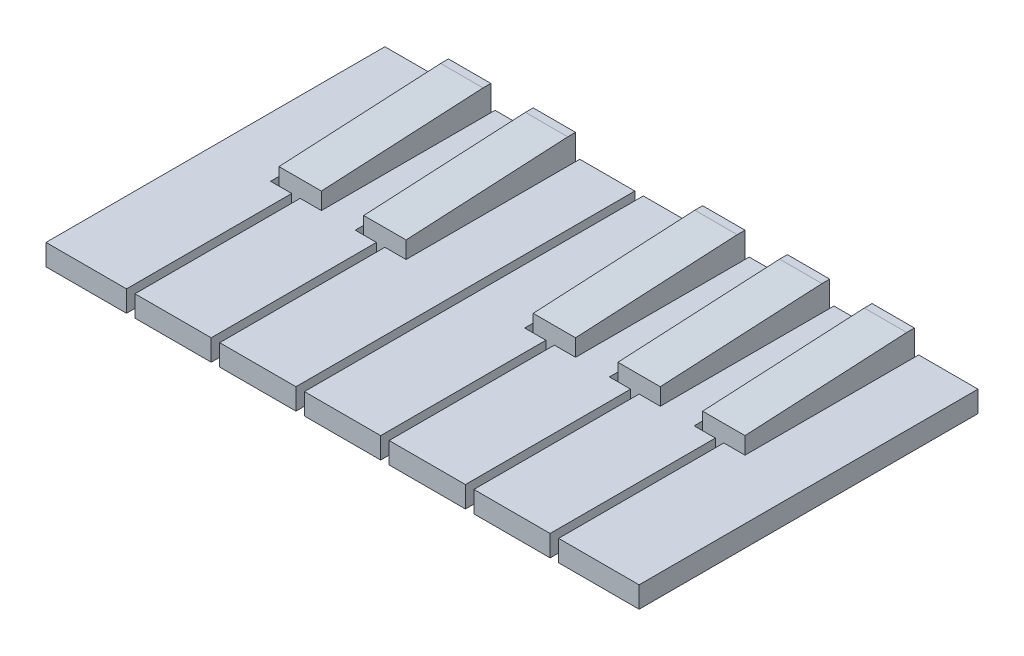
from build123d import *

# Parameters (mm, degrees)
SKETCH1_W             = 10
SKETCH1_H             = 40
BOSS_EXTRUDE1_DEPTH   = 10
BOSS_EXTRUDE1_2_DEPTH = 10
BOSS_EXTRUDE1_3_DEPTH = 10
BOSS_EXTRUDE1_4_DEPTH = 10
BOSS_EXTRUDE1_5_DEPTH = 10
BOSS_EXTRUDE2_DEPTH   = 5
BOSS_EXTRUDE2_2_DEPTH = 5
BOSS_EXTRUDE2_3_DEPTH = 5
BOSS_EXTRUDE2_4_DEPTH = 5
BOSS_EXTRUDE2_5_DEPTH = 5
BOSS_EXTRUDE2_6_DEPTH = 5
BOSS_EXTRUDE2_7_DEPTH = 5
CHAMFER1_SIZE         = 2
CHAMFER1_SIZE2        = 38.162273375
CHAMFER2_SIZE         = 2
CHAMFER2_SIZE2        = 38.162273375
CHAMFER3_SIZE         = 2
CHAMFER3_SIZE2        = 38.162273375
CHAMFER4_SIZE         = 2
CHAMFER4_SIZE2        = 38.162273375
CHAMFER5_SIZE         = 2
CHAMFER5_SIZE2        = 38.162273375


with BuildPart() as part:
    # Sketch1 → Boss-Extrude1 (new body)
    with BuildSketch(Plane(origin=(0, 0, 0), x_dir=(1, 0, 0), z_dir=(0, 1, 0))):
        with Locations((20, 60)):
            Rectangle(SKETCH1_W, SKETCH1_H)
    extrude(amount=BOSS_EXTRUDE1_DEPTH)

    # Chamfer1
    chamfer1_edges = [part.edges().sort_by_distance(p)[0] for p in [
        (20, 10, -40),
    ]]
    chamfer1_side = [part.faces().sort_by_distance(p)[0] for p in [
        (20, 5, -40),
    ]]
    chamfer(chamfer1_edges, length=CHAMFER1_SIZE, length2=CHAMFER1_SIZE2, reference=chamfer1_side[0])


with BuildPart() as body_2:
    # Sketch1 → Boss-Extrude1 2 (new body)
    with BuildSketch(Plane(origin=(0, 0, 0), x_dir=(1, 0, 0), z_dir=(0, 1, 0))):
        with Locations((40, 60)):
            Rectangle(SKETCH1_W, SKETCH1_H)
    extrude(amount=BOSS_EXTRUDE1_2_DEPTH)

    # Chamfer2
    chamfer2_edges = [body_2.edges().sort_by_distance(p)[0] for p in [
        (40, 10, -40),
    ]]
    chamfer2_side = [body_2.faces().sort_by_distance(p)[0] for p in [
        (40, 5, -40),
    ]]
    chamfer(chamfer2_edges, length=CHAMFER2_SIZE, length2=CHAMFER2_SIZE2, reference=chamfer2_side[0])


with BuildPart() as body_3:
    # Sketch1 → Boss-Extrude1 3 (new body)
    with BuildSketch(Plane(origin=(0, 0, 0), x_dir=(1, 0, 0), z_dir=(0, 1, 0))):
        with Locations((80, 60)):
            Rectangle(SKETCH1_W, SKETCH1_H)
    extrude(amount=BOSS_EXTRUDE1_3_DEPTH)

    # Chamfer3
    chamfer3_edges = [body_3.edges().sort_by_distance(p)[0] for p in [
        (80, 10, -40),
    ]]
    chamfer3_side = [body_3.faces().sort_by_distance(p)[0] for p in [
        (80, 5, -40),
    ]]
    chamfer(chamfer3_edges, length=CHAMFER3_SIZE, length2=CHAMFER3_SIZE2, reference=chamfer3_side[0])


with BuildPart() as body_4:
    # Sketch1 → Boss-Extrude1 4 (new body)
    with BuildSketch(Plane(origin=(0, 0, 0), x_dir=(1, 0, 0), z_dir=(0, 1, 0))):
        with Locations((100, 60)):
            Rectangle(SKETCH1_W, SKETCH1_H)
    extrude(amount=BOSS_EXTRUDE1_4_DEPTH)

    # Chamfer4
    chamfer4_edges = [body_4.edges().sort_by_distance(p)[0] for p in [
        (100, 10, -40),
    ]]
    chamfer4_side = [body_4.faces().sort_by_distance(p)[0] for p in [
        (100, 5, -40),
    ]]
    chamfer(chamfer4_edges, length=CHAMFER4_SIZE, length2=CHAMFER4_SIZE2, reference=chamfer4_side[0])


with BuildPart() as body_5:
    # Sketch1 → Boss-Extrude1 5 (new body)
    with BuildSketch(Plane(origin=(0, 0, 0), x_dir=(1, 0, 0), z_dir=(0, 1, 0))):
        with Locations((120, 60)):
            Rectangle(SKETCH1_W, SKETCH1_H)
    extrude(amount=BOSS_EXTRUDE1_5_DEPTH)

    # Chamfer5
    chamfer5_edges = [body_5.edges().sort_by_distance(p)[0] for p in [
        (120, 10, -40),
    ]]
    chamfer5_side = [body_5.faces().sort_by_distance(p)[0] for p in [
        (120, 5, -40),
    ]]
    chamfer(chamfer5_edges, length=CHAMFER5_SIZE, length2=CHAMFER5_SIZE2, reference=chamfer5_side[0])


with BuildPart() as body_6:
    # Sketch1<3> → Boss-Extrude2 (new body)
    with BuildSketch(Plane(origin=(0, 0, 0), x_dir=(1, 0, 0), z_dir=(0, 1, 0))):
        Polygon((0, 80), (0, 0), (19, 0), (19, 39), (14, 39), (14, 80), align=None)
    extrude(amount=BOSS_EXTRUDE2_DEPTH)


with BuildPart() as body_7:
    # Sketch1<3> → Boss-Extrude2 2 (new body)
    with BuildSketch(Plane(origin=(0, 0, 0), x_dir=(1, 0, 0), z_dir=(0, 1, 0))):
        Polygon((21, 39), (21, 0), (39, 0), (39, 39), (34, 39), (34, 80), (26, 80), (26, 39), align=None)
    extrude(amount=BOSS_EXTRUDE2_2_DEPTH)


with BuildPart() as body_8:
    # Sketch1<3> → Boss-Extrude2 3 (new body)
    with BuildSketch(Plane(origin=(0, 0, 0), x_dir=(1, 0, 0), z_dir=(0, 1, 0))):
        Polygon((41, 39), (41, 0), (59, 0), (59, 80), (46, 80), (46, 39), align=None)
    extrude(amount=BOSS_EXTRUDE2_3_DEPTH)


with BuildPart() as body_9:
    # Sketch1<3> → Boss-Extrude2 4 (new body)
    with BuildSketch(Plane(origin=(0, 0, 0), x_dir=(1, 0, 0), z_dir=(0, 1, 0))):
        Polygon((61, 80), (61, 0), (79, 0), (79, 39), (74, 39), (74, 80), align=None)
    extrude(amount=BOSS_EXTRUDE2_4_DEPTH)


with BuildPart() as body_10:
    # Sketch1<3> → Boss-Extrude2 5 (new body)
    with BuildSketch(Plane(origin=(0, 0, 0), x_dir=(1, 0, 0), z_dir=(0, 1, 0))):
        Polygon((81, 39), (81, 0), (99, 0), (99, 39), (94, 39), (94, 80), (86, 80), (86, 39), align=None)
    extrude(amount=BOSS_EXTRUDE2_5_DEPTH)


with BuildPart() as body_11:
    # Sketch1<3> → Boss-Extrude2 6 (new body)
    with BuildSketch(Plane(origin=(0, 0, 0), x_dir=(1, 0, 0), z_dir=(0, 1, 0))):
        Polygon((101, 39), (101, 0), (119, 0), (119, 39), (114, 39), (114, 80), (106, 80), (106, 39), align=None)
    extrude(amount=BOSS_EXTRUDE2_6_DEPTH)


with BuildPart() as body_12:
    # Sketch1<3> → Boss-Extrude2 7 (new body)
    with BuildSketch(Plane(origin=(0, 0, 0), x_dir=(1, 0, 0), z_dir=(0, 1, 0))):
        Polygon((121, 39), (121, 0), (140, 0), (140, 80), (126, 80), (126, 39), align=None)
    extrude(amount=BOSS_EXTRUDE2_7_DEPTH)


solid = Compound([part.part, body_2.part, body_3.part, body_4.part, body_5.part, body_6.part, body_7.part, body_8.part, body_9.part, body_10.part, body_11.part, body_12.part])
